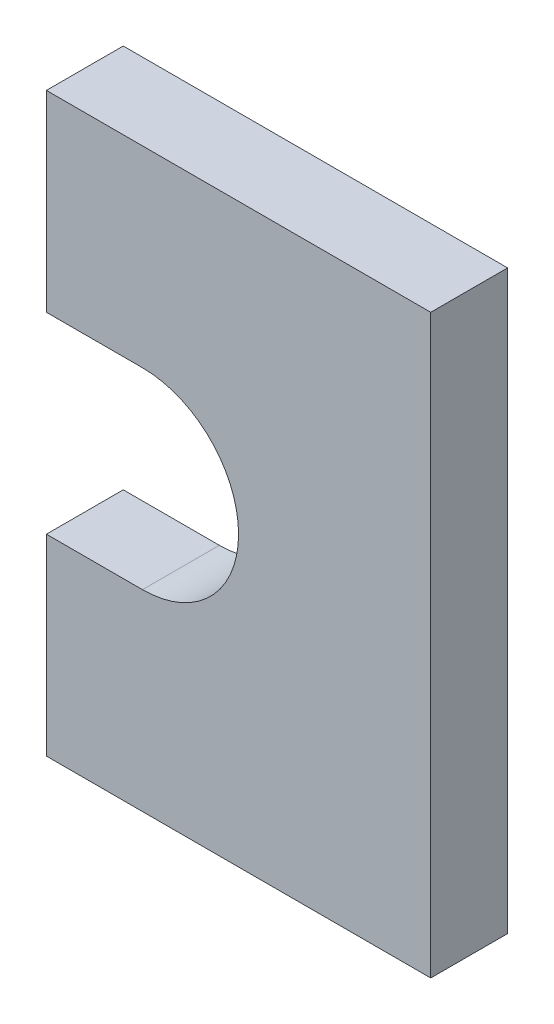
from build123d import *

# Parameters (mm, degrees)
BOSS_EXTRUDE1_DEPTH = 2


with BuildPart() as part:
    # Sketch1 → Boss-Extrude1 (new body)
    with BuildSketch(Plane.XY):
        with BuildLine():
            Line((-5, 2.5), (-5, 7.5))
            Line((-5, 7.5), (5, 7.5))
            Line((5, 7.5), (5, -7.5))
            Line((5, -7.5), (-5, -7.5))
            Line((-5, -7.5), (-5, -2.5))
            Line((-5, -2.5), (-2.5, -2.5))
            ThreePointArc((-2.5, -2.5), (0, 0), (-2.5, 2.5))
            Line((-2.5, 2.5), (-5, 2.5))
        make_face()
    extrude(amount=BOSS_EXTRUDE1_DEPTH)


solid = part.part
